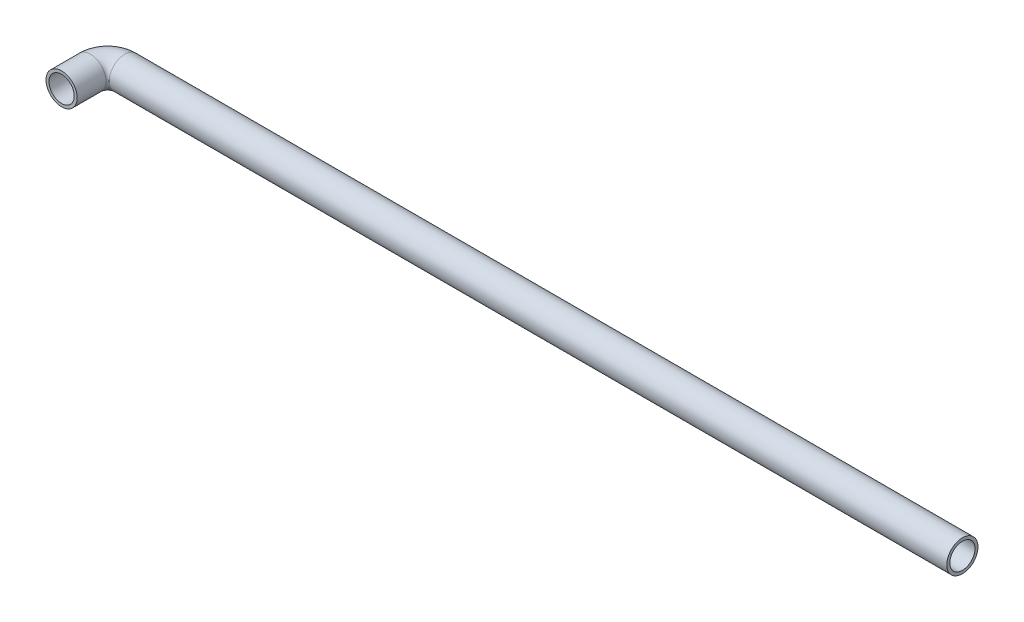
from build123d import *

# Parameters (mm, degrees)
SKETCH1_R   = 6.858
SKETCH1_R_2 = 5.55625


with BuildPart() as part:
    # Sweep1: sweep along a path in Sketch2
    with BuildLine(Plane(origin=(0, 0, 0), x_dir=(1, 0, 0), z_dir=(0, 1, 0))) as sweep1_path:
        Line((0, 0), (0, 12.7))
        ThreePointArc((0, 12.7), (2.208658133, 18.03217242), (7.540830553, 20.240830553))
        Line((7.540830553, 20.240830553), (375.840830553, 20.240830553))
    # Sketch1 → Sweep1 (sweep)
    with BuildSketch(Plane.XY):
        Circle(SKETCH1_R)
        Circle(SKETCH1_R_2, mode=Mode.SUBTRACT)
    sweep(path=sweep1_path.line)


solid = part.part
